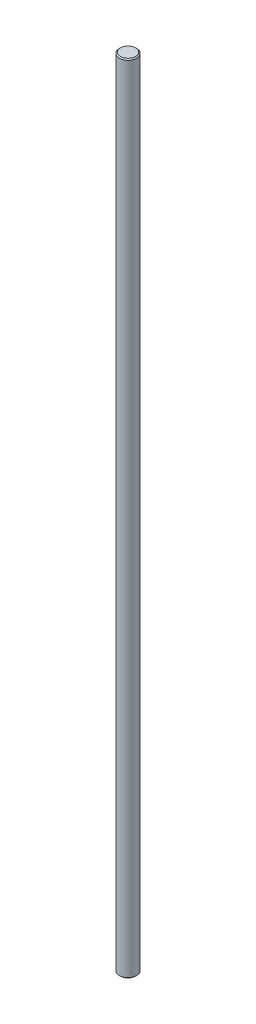
from build123d import *

# Parameters (mm, degrees)
ESBO_O3_R                = 4
RESSALTO_EXTRUS_O1_DEPTH = 185
CHANFRO1_SIZE            = 0.5


with BuildPart() as part:
    # Esboço3 → Ressalto-extrusão1 (new, symmetric)
    with BuildSketch(Plane(origin=(0, 0, 0), x_dir=(1, 0, 0), z_dir=(0, 1, 0))):
        with Locations(Location((0, 0, 0), (0, 0, 270))):
            Circle(ESBO_O3_R)
    extrude(amount=RESSALTO_EXTRUS_O1_DEPTH, both=True)

    # Chanfro1
    chanfro1_edges = [part.edges().sort_by_distance(p)[0] for p in [
        (0, -185, -4),
        (0, 185, -4),
    ]]
    chamfer(chanfro1_edges, length=CHANFRO1_SIZE)


solid = part.part
